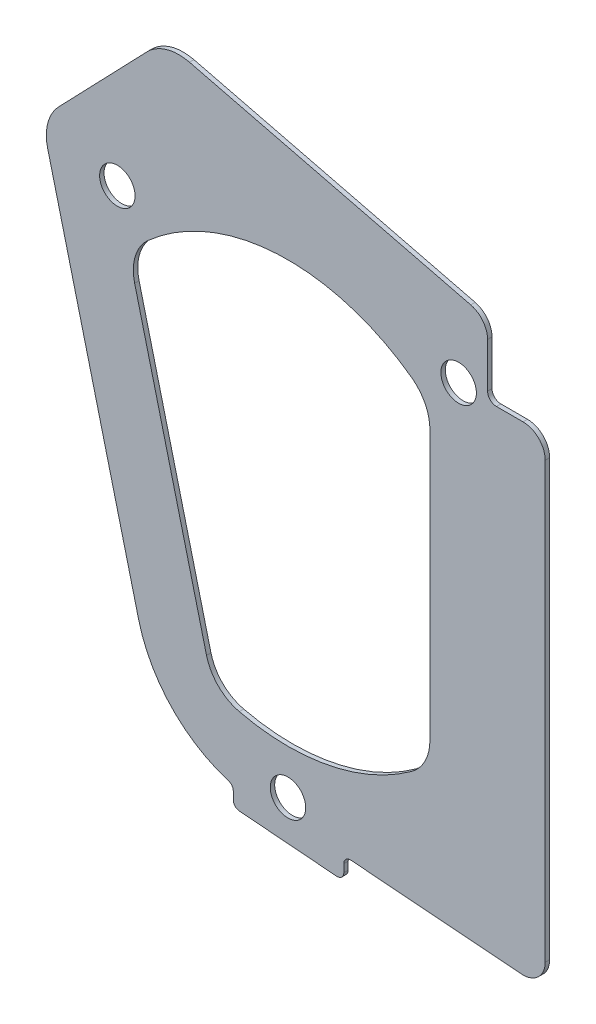
from build123d import *

# Parameters (mm, degrees)
SKETCH1_R         = 4
BUMPER_LINK_DEPTH = 1


with BuildPart() as part:
    # Sketch1 → Bumper link (new body)
    with BuildSketch(Plane.XY):
        with BuildLine():
            Line((-12.339935794, -62.372114787), (-12.339935794, -64.125193558))
            ThreePointArc((-12.339935794, -64.125193558), (-11.942206179, -65.142543055), (-10.959935794, -65.620385853))
            Line((-10.959935794, -65.620385853), (10.959935794, -67.379614147))
            ThreePointArc((10.959935794, -67.379614147), (12.097285292, -66.986692236), (12.579935794, -65.884421852))
            Line((12.579935794, -65.884421852), (12.579935794, -64.13134308))
            ThreePointArc((12.579935794, -64.13134308), (13.061403486, -63.030165558), (14.196725042, -62.635896568))
            Line((14.196725042, -62.635896568), (52.610702507, -65.635896568))
            ThreePointArc((52.610702507, -65.635896568), (56.395107696, -64.321666601), (58, -60.65107486))
            Line((58, -60.65107486), (58, 37.364103432))
            ThreePointArc((58, 37.364103432), (56.535533906, 40.899637338), (53, 42.364103432))
            Line((53, 42.364103432), (47, 42.364103432))
            ThreePointArc((47, 42.364103432), (45.585786438, 42.94988987), (45, 44.364103432))
            Line((45, 44.364103432), (45, 54.449696626))
            ThreePointArc((45, 54.449696626), (43.937003937, 57.531903627), (41.2, 59.303561066))
            Line((41.2, 59.303561066), (-22.203206715, 74.978462786))
            ThreePointArc((-22.203206715, 74.978462786), (-27.378610186, 74.877873729), (-31.810346538, 72.203059315))
            Line((-31.810346538, 72.203059315), (-51.696396663, 51.528677297))
            ThreePointArc((-51.696396663, 51.528677297), (-54.153116802, 47.167307088), (-54.188361237, 42.161732018))
            Line((-54.188361237, 42.161732018), (-33.67267763, -39.569202441))
            ThreePointArc((-33.67267763, -39.569202441), (-26.339013672, -52.913431655), (-13.39876573, -60.938458979))
            ThreePointArc((-13.39876573, -60.938458979), (-12.633338286, -61.480979302), (-12.339935794, -62.372114787))
        make_face()
        with Locations((0, -57.5)):
            Circle(SKETCH1_R, mode=Mode.SUBTRACT)
        with Locations((-38.475009866, 42.730827465)):
            Circle(SKETCH1_R, mode=Mode.SUBTRACT)
        with Locations((38.475009866, 42.730827465)):
            Circle(SKETCH1_R, mode=Mode.SUBTRACT)
        with BuildLine():
            Line((32, 30.368569278), (32, -30.368569278))
            ThreePointArc((32, -30.368569278), (30.906926144, -34.914629844), (27.866666667, -38.466854419))
            ThreePointArc((27.866666667, -38.466854419), (9.287328638, -46.583210782), (-10.984071313, -46.212554327))
            ThreePointArc((-10.984071313, -46.212554327), (-15.698093899, -43.598992826), (-18.370739643, -38.918215391))
            Line((-18.370739643, -38.918215391), (-34.572943336, 25.628561282))
            ThreePointArc((-34.572943336, 25.628561282), (-34.427736148, 31.016661832), (-31.506862657, 35.546696127))
            ThreePointArc((-31.506862657, 35.546696127), (-2.333364057, 47.442653933), (27.866666667, 38.466854419))
            ThreePointArc((27.866666667, 38.466854419), (30.906926144, 34.914629844), (32, 30.368569278))
        make_face(mode=Mode.SUBTRACT)
    extrude(amount=BUMPER_LINK_DEPTH)


solid = part.part
